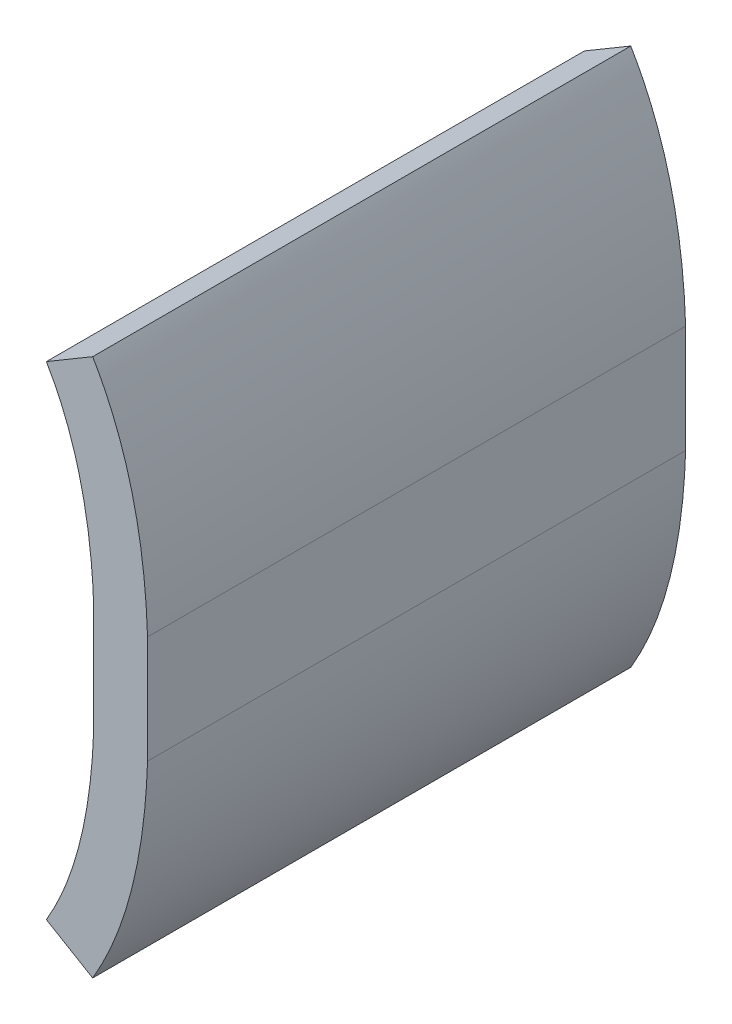
from build123d import *

# Parameters (mm, degrees)
BOSS_EXTRUDE1_DEPTH = 100


with BuildPart() as part:
    # Sketch1 → Boss-Extrude1 (new body)
    with BuildSketch(Plane.XY):
        with BuildLine():
            Line((0, 0), (0, 10))
            add(Edge.make_bspline(
                [(0, 10), (-0.787242099, 34.100733869), (-10.197534483, 50)],
                knots=[0, 0, 0, 1, 1, 1], degree=2))
            Line((-10.197534483, 50), (-18.803177319, 44.906581563))
            add(Edge.make_bspline(
                [(-10, 9.833471065), (-10.030967353, 10.744471696), (-10.114706096, 12.582680835), (-10.361531, 16.119334261), (-10.820269758, 20.371956037), (-11.603430489, 25.176045178), (-12.949670493, 31.196907646), (-14.728828853, 36.634857764), (-16.928703227, 41.544185237), (-18.144309171, 43.793383416), (-18.803177319, 44.906581563)],
                knots=[0.003595485, 0.003595485, 0.003595485, 0.003595485, 0.065870767, 0.12814605, 0.252696614, 0.377247178, 0.501797743, 0.750898871, 0.875449436, 1, 1, 1, 1], degree=3))
            Line((-10, 9.833471065), (-10, 0))
            Line((-10, 0), (-10, -9.833471065))
            add(Edge.make_bspline(
                [(-18.803177319, -44.906581563), (-18.144309171, -43.793383416), (-16.928703227, -41.544185237), (-14.728828853, -36.634857764), (-12.949670493, -31.196907646), (-11.603430489, -25.176045178), (-10.820269758, -20.371956037), (-10.361531, -16.119334261), (-10.114706096, -12.582680835), (-10.030967353, -10.744471696), (-10, -9.833471065)],
                knots=[0.003595485, 0.003595485, 0.003595485, 0.003595485, 0.12814605, 0.252696614, 0.501797743, 0.626348307, 0.750898871, 0.875449436, 0.937724718, 1, 1, 1, 1], degree=3))
            Line((-18.803177319, -44.906581563), (-10.197534483, -50))
            add(Edge.make_bspline(
                [(0, -10), (-0.787242099, -34.100733869), (-10.197534483, -50)],
                knots=[0, 0, 0, 1, 1, 1], degree=2))
            Line((0, -10), (0, 0))
        make_face()
    extrude(amount=BOSS_EXTRUDE1_DEPTH)


solid = part.part
